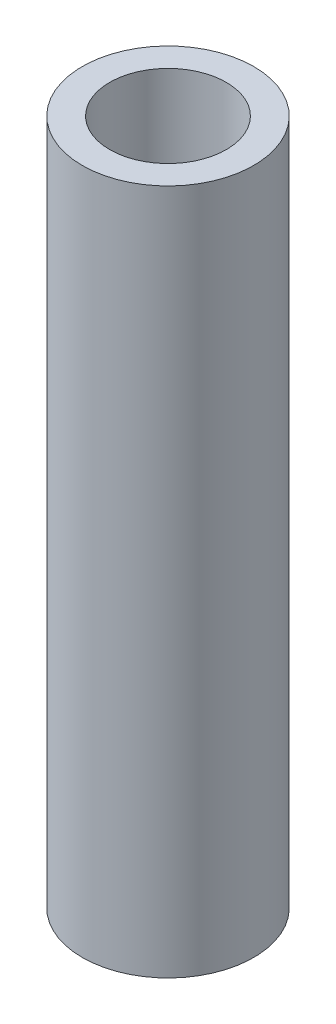
from build123d import *

# Parameters (mm, degrees)
SKETCH1_R            = 2.5
BOSS_EXTRUDE1_DEPTH  = 20
M3_CLEARANCE_HOLE1_D = 3.4


with BuildPart() as part:
    # Sketch1 → Boss-Extrude1 (new body)
    with BuildSketch(Plane(origin=(0, 0, 0), x_dir=(1, 0, 0), z_dir=(0, 1, 0))):
        with Locations(Location((0, 0, 0), (0, 0, 270))):
            Circle(SKETCH1_R)
    extrude(amount=BOSS_EXTRUDE1_DEPTH)

    # M3 Clearance Hole1 (through all)
    with Locations(Plane.ZX.offset(20)):
        with Locations((0, 0)):
            Hole(M3_CLEARANCE_HOLE1_D / 2)


solid = part.part
